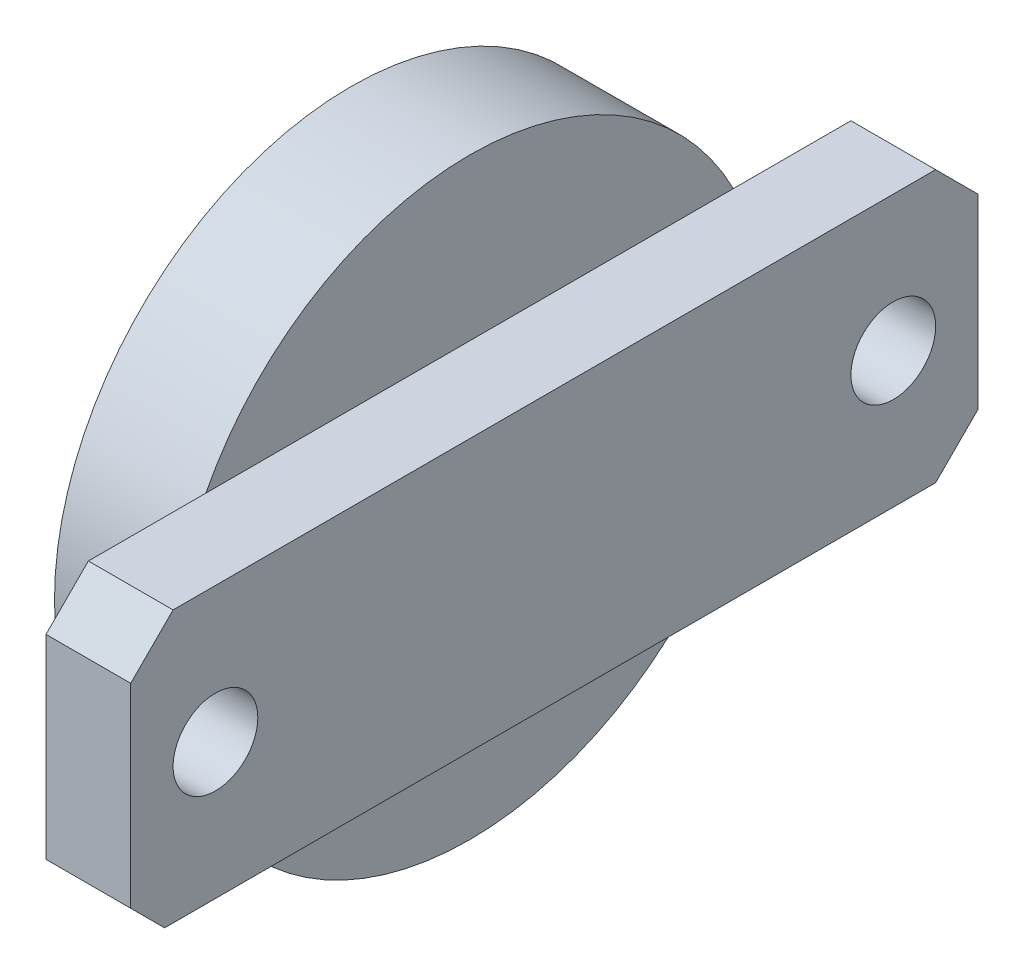
from build123d import *

# Parameters (mm, degrees)
SKETCH1_W                    = 50
SKETCH1_H                    = 16
BOSS_EXTRUDE1_DEPTH          = 5
SKETCH2_W                    = 7
SKETCH2_H                    = 14
F_5_0_5_DIAMETER_HOLE1_D     = 5
F_5_0_5_DIAMETER_HOLE1_DEPTH = 12
CHAMFER1_SIZE                = 2.5
CHAMFER2_SIZE                = 2
SKETCH5_R                    = 17.5
BOSS_EXTRUDE2_DEPTH          = 7


with BuildPart() as part:
    # Sketch1 → Boss-Extrude1 (new body)
    with BuildSketch(Plane(origin=(5, 0, 0), x_dir=(0, 0, -1), z_dir=(1, 0, 0))):
        Rectangle(SKETCH1_W, SKETCH1_H)
    extrude(amount=-BOSS_EXTRUDE1_DEPTH)

    # Sketch2 → Revolve1 (revolve)
    with BuildSketch(Plane(origin=(0, 0, 0), x_dir=(-1, 0, 0), z_dir=(0, 0, -1)), mode=Mode.PRIVATE) as revolve1_sk:
        with Locations((3.5, 7)):
            Rectangle(SKETCH2_W, SKETCH2_H)
    revolve(revolve1_sk.sketch.rotate(Axis((0, 0, 0), (-1, 0, 0)), 270), axis=Axis((0, 0, 0), (-1, 0, 0)))

    # Ø5.0 (5) Diameter Hole1
    with Locations(Plane(origin=(5, 0, 0), x_dir=(0, 0, -1), z_dir=(1, 0, 0))):
        with Locations((-20, 0), (20, 0)):
            Hole(F_5_0_5_DIAMETER_HOLE1_D / 2, depth=F_5_0_5_DIAMETER_HOLE1_DEPTH)

    # Chamfer1
    chamfer1_edges = [part.edges().sort_by_distance(p)[0] for p in [
        (2.5, 8, 25),
        (2.5, 8, -25),
        (2.5, -8, -25),
    ]]
    chamfer(chamfer1_edges, length=CHAMFER1_SIZE)

    # Chamfer2
    chamfer2_edges = [part.edges().sort_by_distance(p)[0] for p in [
        (2.5, -8, 25),
    ]]
    chamfer(chamfer2_edges, length=CHAMFER2_SIZE)

    # Sketch5 → Boss-Extrude2 (add)
    with BuildSketch(Plane.ZY.offset(7)):
        Circle(SKETCH5_R)
    extrude(amount=-BOSS_EXTRUDE2_DEPTH)


solid = part.part
